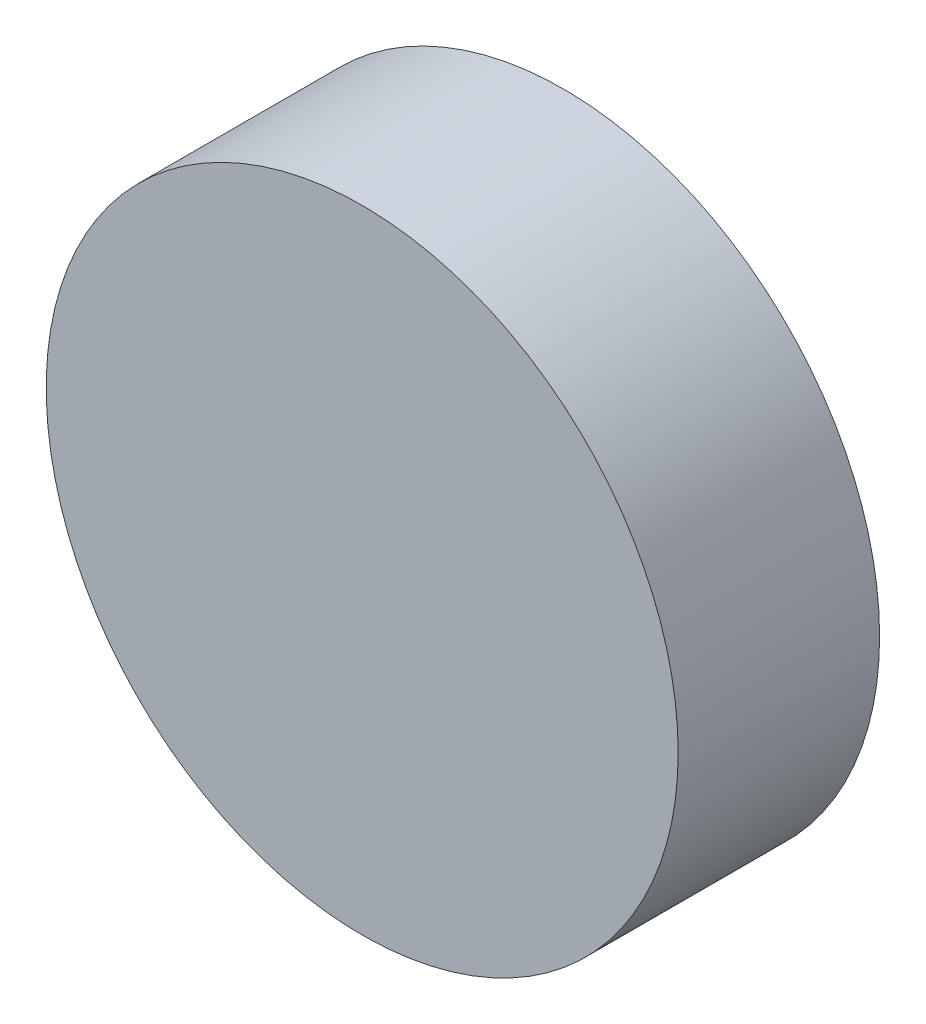
from build123d import *

# Parameters (mm, degrees)
SKETCH1_R           = 40
BOSS_EXTRUDE1_DEPTH = 25.5
SKETCH2_R           = 3.45
CUT_EXTRUDE1_DEPTH  = 5


with BuildPart() as part:
    # Sketch1 → Boss-Extrude1 (new body)
    with BuildSketch(Plane.XY):
        Circle(SKETCH1_R)
    extrude(amount=BOSS_EXTRUDE1_DEPTH)

    # Sketch2 → Cut-Extrude1 (cut)
    with BuildSketch(Plane(origin=(0, 0, 0), x_dir=(-1, 0, 0), z_dir=(0, 0, -1))):
        with Locations((0, 33.65)):
            Circle(SKETCH2_R)
        with Locations((33.65, 0)):
            Circle(SKETCH2_R)
        with Locations(Location((0, -33.65, 0), (0, 0, 180))):
            Circle(SKETCH2_R)
        with Locations(Location((-33.65, 0, 0), (0, 0, 180))):
            Circle(SKETCH2_R)
    extrude(amount=-CUT_EXTRUDE1_DEPTH, mode=Mode.SUBTRACT)


solid = part.part
